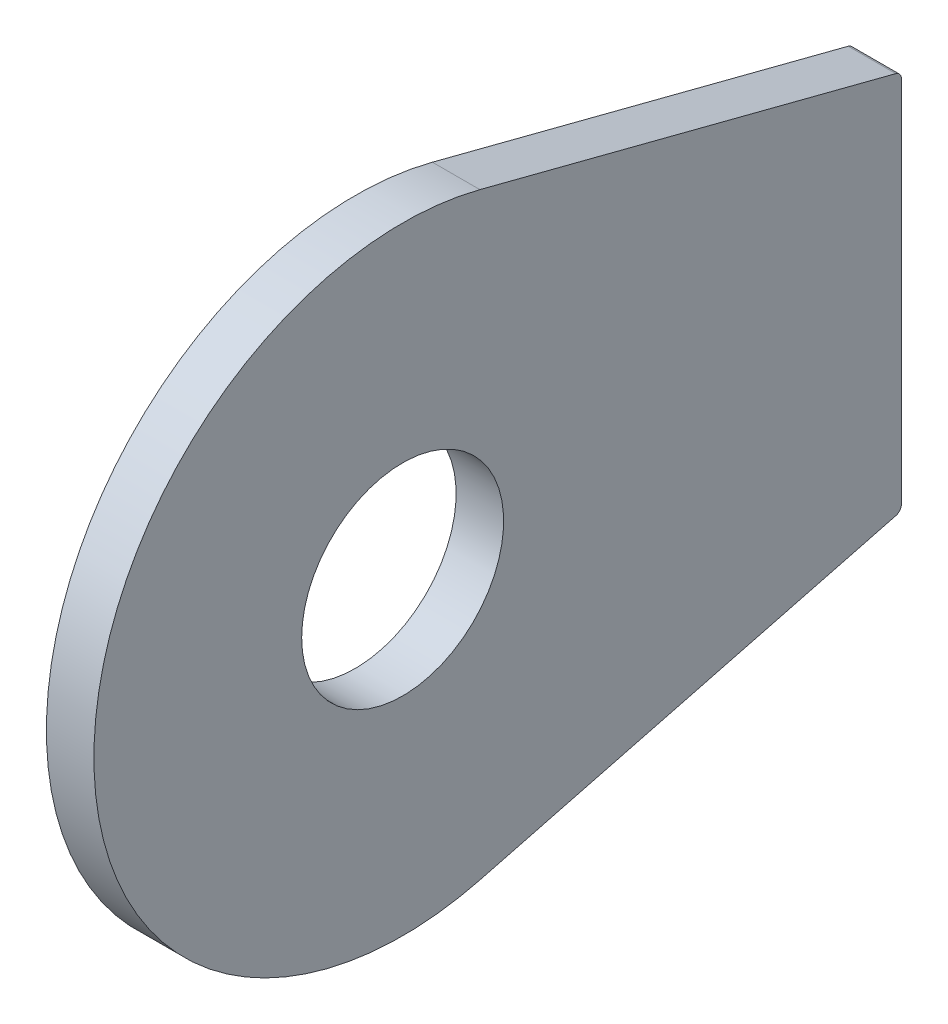
from build123d import *

# Parameters (mm, degrees)
SKETCH1_R             = 6.749999962
BOSS_EXTRUDE1_DEPTH   = 1.5875
FILLET1_R             = 0.508
FILLET2_R             = 0.508
M12_CLEARANCE_HOLE1_D = 13.5


with BuildPart() as part:
    # Sketch1 → Boss-Extrude1 (new, symmetric)
    # profile 1 of 2: a face of its own
    with BuildSketch(Plane(origin=(0, 0, 0), x_dir=(0, 0, -1), z_dir=(1, 0, 0))):
        with BuildLine():
            Line((33.3375, -12.7), (5.163771309, -19.981037814))
            ThreePointArc((5.163771309, -19.981037814), (-20.6375, 0), (5.163771309, 19.981037814))
            Line((5.163771309, 19.981037814), (33.3375, 12.7))
            Line((33.3375, 12.7), (33.3375, -12.7))
        make_face()
        Circle(SKETCH1_R, mode=Mode.SUBTRACT)
    # profile 2 of 2: a face of its own
    with BuildSketch(Plane(origin=(0, 0, 0), x_dir=(0, 0, -1), z_dir=(1, 0, 0))):
        Circle(SKETCH1_R)
    extrude(amount=BOSS_EXTRUDE1_DEPTH, both=True)

    # Fillet1
    fillet1_edges = [part.edges().sort_by_distance(p)[0] for p in [
        (0, -12.7, -33.3375),
    ]]
    fillet(fillet1_edges, radius=FILLET1_R)

    # Fillet2
    fillet2_edges = [part.edges().sort_by_distance(p)[0] for p in [
        (0, 12.7, -33.3375),
    ]]
    fillet(fillet2_edges, radius=FILLET2_R)

    # M12 Clearance Hole1 (through all)
    with Locations(Plane.ZY.offset(1.5875)):
        with Locations((0, 0)):
            Hole(M12_CLEARANCE_HOLE1_D / 2)


solid = part.part
